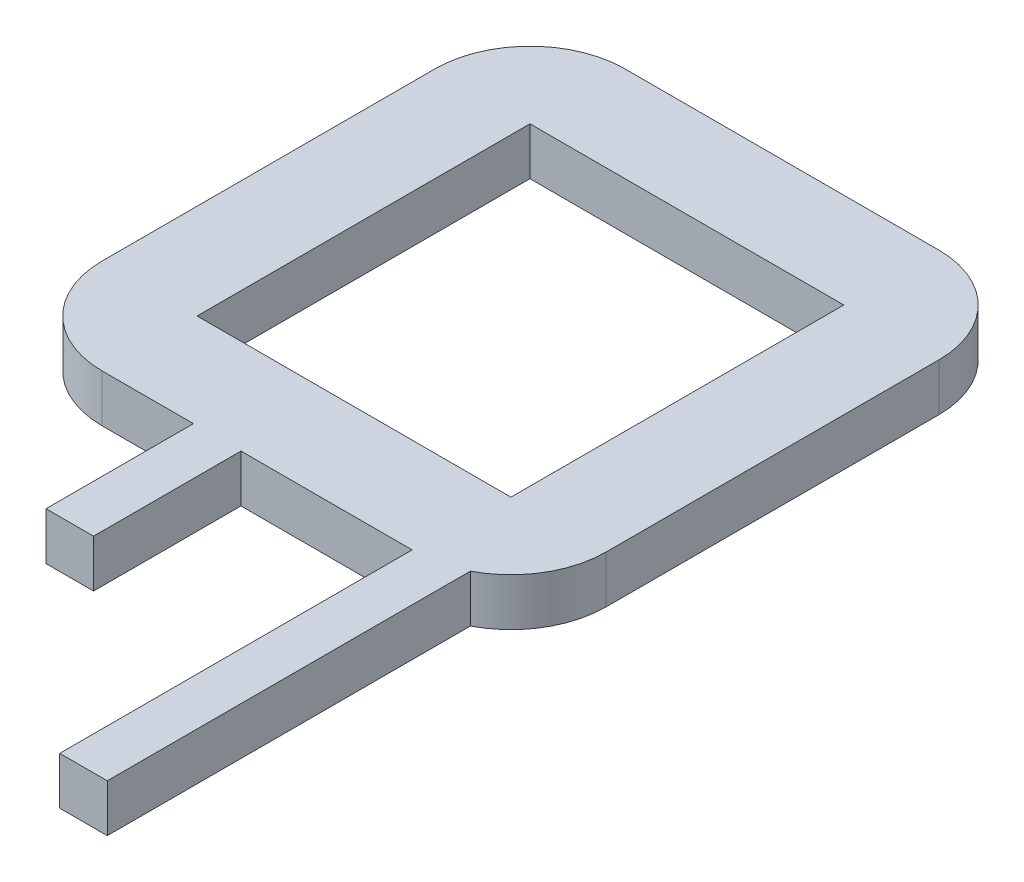
from build123d import *

# Parameters (mm, degrees)
SKETCH_1_W      = 33
SKETCH_1_H      = 35
SKETCH_1_W_2    = 5
SKETCH_1_H_2    = 40
SKETCH_1_H_3    = 15.5
EXTRUDE_1_DEPTH = 5


with BuildPart() as part:
    # 草圖1 → 填料-伸長1 (new body)
    # profile 1 of 3: a face of its own
    with BuildSketch(Plane(origin=(0, 0, 0), x_dir=(1, 0, 0), z_dir=(0, 1, 0))):
        with BuildLine():
            Line((16.5, -27.5), (-16.5, -27.5))
            ThreePointArc((-16.5, -27.5), (-23.571067812, -24.571067812), (-26.5, -17.5))
            Line((-26.5, -17.5), (-26.5, 17.5))
            ThreePointArc((-26.5, 17.5), (-23.571067812, 24.571067812), (-16.5, 27.5))
            Line((-16.5, 27.5), (16.5, 27.5))
            ThreePointArc((16.5, 27.5), (23.571067812, 24.571067812), (26.5, 17.5))
            Line((26.5, 17.5), (26.5, -17.5))
            ThreePointArc((26.5, -17.5), (23.571067812, -24.571067812), (16.5, -27.5))
        make_face()
        Rectangle(SKETCH_1_W, SKETCH_1_H, mode=Mode.SUBTRACT)
    # profile 2 of 3: a face of its own
    with BuildSketch(Plane(origin=(0, 0, 0), x_dir=(1, 0, 0), z_dir=(0, 1, 0))):
        with Locations((18.607544966, -44.554985824)):
            Rectangle(SKETCH_1_W_2, SKETCH_1_H_2)
    # profile 3 of 3: a face of its own
    with BuildSketch(Plane(origin=(0, 0, 0), x_dir=(1, 0, 0), z_dir=(0, 1, 0))):
        with Locations((-4.392455034, -35.25)):
            Rectangle(SKETCH_1_W_2, SKETCH_1_H_3)
    extrude(amount=EXTRUDE_1_DEPTH)


solid = part.part
